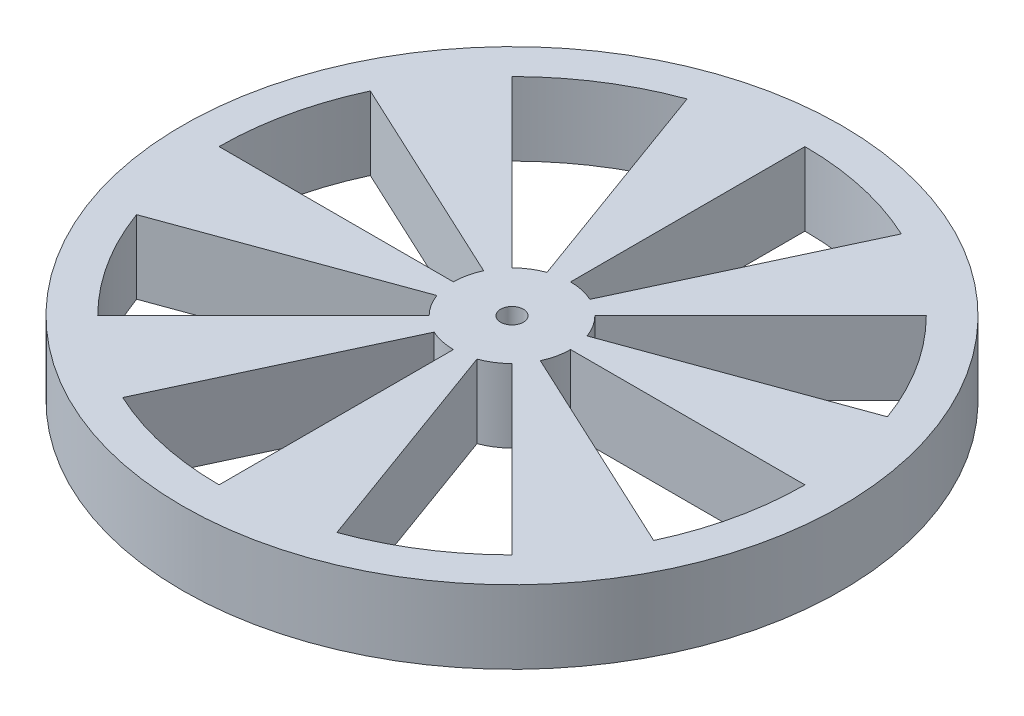
from build123d import *

# Parameters (mm, degrees)
SKETCH1_R           = 45
SKETCH1_R_2         = 8
SKETCH1_R_3         = 1.55
BOSS_EXTRUDE1_DEPTH = 10


with BuildPart() as part:
    # Sketch1 → Boss-Extrude1 (new body)
    # profile 1 of 2: a face of its own
    with BuildSketch(Plane(origin=(0, 0, 0), x_dir=(1, 0, 0), z_dir=(0, 1, 0))):
        with Locations(Location((0, 0, 0), (0, 0, 270))):
            Circle(SKETCH1_R)
        with BuildLine():
            Line((0, 8), (0, 40))
            ThreePointArc((0, 40), (8.657584558, 39.051840285), (16.90473047, 36.252311481))
            Line((16.90473047, 36.252311481), (3.380946094, 7.250462296))
            ThreePointArc((3.380946094, 7.250462296), (4.588611491, 6.553216354), (5.656854249, 5.656854249))
            Line((5.656854249, 5.656854249), (28.284271247, 28.284271247))
            ThreePointArc((28.284271247, 28.284271247), (33.735657833, 21.491984334), (37.587704831, 13.680805733))
            Line((37.587704831, 13.680805733), (7.517540966, 2.736161147))
            ThreePointArc((7.517540966, 2.736161147), (7.878462024, 1.389185421), (8, 0))
            Line((8, 0), (40, 0))
            ThreePointArc((40, 0), (39.051840285, -8.657584558), (36.252311481, -16.90473047))
            Line((36.252311481, -16.90473047), (7.250462296, -3.380946094))
            ThreePointArc((7.250462296, -3.380946094), (6.553216354, -4.588611491), (5.656854249, -5.656854249))
            Line((5.656854249, -5.656854249), (28.284271247, -28.284271247))
            ThreePointArc((28.284271247, -28.284271247), (21.491984334, -33.735657833), (13.680805733, -37.587704831))
            Line((13.680805733, -37.587704831), (2.736161147, -7.517540966))
            ThreePointArc((2.736161147, -7.517540966), (1.389185421, -7.878462024), (0, -8))
            Line((0, -8), (0, -40))
            ThreePointArc((0, -40), (-8.657584558, -39.051840285), (-16.90473047, -36.252311481))
            Line((-16.90473047, -36.252311481), (-3.380946094, -7.250462296))
            ThreePointArc((-3.380946094, -7.250462296), (-4.588611491, -6.553216354), (-5.656854249, -5.656854249))
            Line((-5.656854249, -5.656854249), (-28.284271247, -28.284271247))
            ThreePointArc((-28.284271247, -28.284271247), (-33.735657833, -21.491984334), (-37.587704831, -13.680805733))
            Line((-37.587704831, -13.680805733), (-7.517540966, -2.736161147))
            ThreePointArc((-7.517540966, -2.736161147), (-7.878462024, -1.389185421), (-8, 0))
            Line((-8, 0), (-40, 0))
            ThreePointArc((-40, 0), (-39.051840285, 8.657584558), (-36.252311481, 16.90473047))
            Line((-36.252311481, 16.90473047), (-7.250462296, 3.380946094))
            ThreePointArc((-7.250462296, 3.380946094), (-6.553216354, 4.588611491), (-5.656854249, 5.656854249))
            Line((-5.656854249, 5.656854249), (-28.284271247, 28.284271247))
            ThreePointArc((-28.284271247, 28.284271247), (-21.491984334, 33.735657833), (-13.680805733, 37.587704831))
            Line((-13.680805733, 37.587704831), (-2.736161147, 7.517540966))
            ThreePointArc((-2.736161147, 7.517540966), (-1.389185421, 7.878462024), (0, 8))
        make_face(mode=Mode.SUBTRACT)
    # profile 2 of 2: a face of its own
    with BuildSketch(Plane(origin=(0, 0, 0), x_dir=(1, 0, 0), z_dir=(0, 1, 0))):
        Circle(SKETCH1_R_2)
        with Locations(Location((0, 0, 0), (0, 0, 270))):
            Circle(SKETCH1_R_3, mode=Mode.SUBTRACT)
    extrude(amount=BOSS_EXTRUDE1_DEPTH)


solid = part.part
